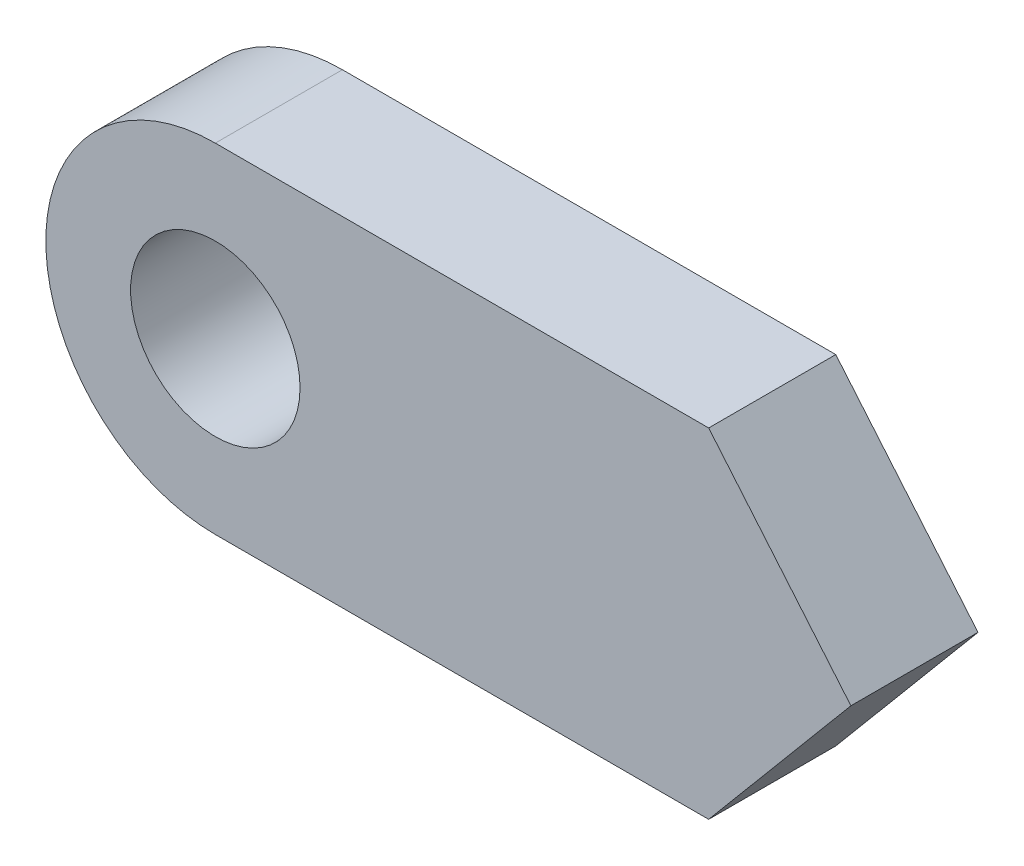
from build123d import *

# Parameters (mm, degrees)
SKETCH2_R           = 20
BOSS_EXTRUDE1_DEPTH = 30


with BuildPart() as part:
    # Sketch2 → Boss-Extrude1 (new body)
    with BuildSketch(Plane.XY):
        with BuildLine():
            Line((0, 0), (116.439999925, 0))
            Line((116.439999925, 0), (150.003985172, -40))
            Line((150.003985172, -40), (116.439999925, -80))
            Line((116.439999925, -80), (0, -80))
            ThreePointArc((0, -80), (-40, -40), (0, 0))
        make_face()
        with Locations((0, -40)):
            Circle(SKETCH2_R, mode=Mode.SUBTRACT)
    extrude(amount=BOSS_EXTRUDE1_DEPTH)


solid = part.part
